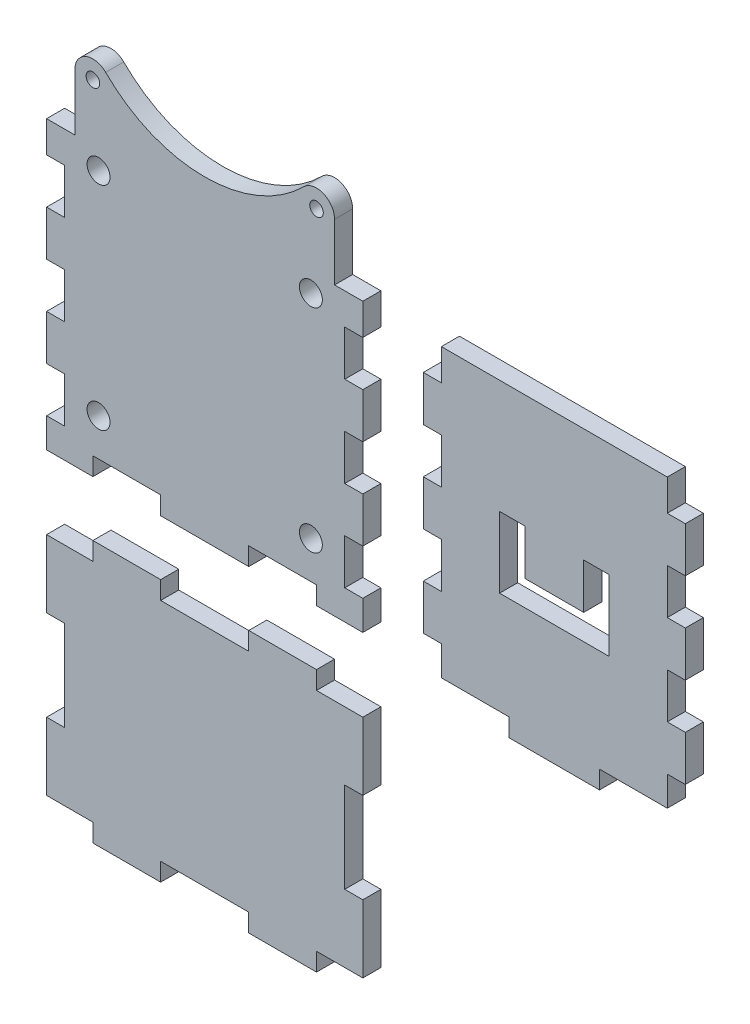
from build123d import *

# Parameters (mm, degrees)
SKETCH1_R             = 2.54
SKETCH1_R_2           = 1.5
BOSS_EXTRUDE1_DEPTH   = 4
BOSS_EXTRUDE1_2_DEPTH = 4
BOSS_EXTRUDE1_3_DEPTH = 4


with BuildPart() as part:
    # Sketch1 → Boss-Extrude1 (new body)
    with BuildSketch(Plane.XY):
        with BuildLine():
            Line((-35, -94.278824944), (-35, -100.830704015))
            Line((-35, -100.830704015), (-24.748737342, -100.830704015))
            Line((-24.748737342, -100.830704015), (-24.748737342, -96.830704015))
            Line((-24.748737342, -96.830704015), (-9.748737342, -96.830704015))
            Line((-9.748737342, -96.830704015), (-9.748737342, -100.830704015))
            Line((-9.748737342, -100.830704015), (9.748737342, -100.830704015))
            Line((9.748737342, -100.830704015), (9.748737342, -96.830704015))
            Line((9.748737342, -96.830704015), (24.748737342, -96.830704015))
            Line((24.748737342, -96.830704015), (24.748737342, -100.830704015))
            Line((24.748737342, -100.830704015), (35, -100.830704015))
            Line((35, -100.830704015), (35, -94.278824944))
            Line((35, -94.278824944), (31, -94.278824944))
            Line((31, -94.278824944), (31, -84.278824944))
            Line((31, -84.278824944), (35, -84.278824944))
            Line((35, -84.278824944), (35, -74.278824944))
            Line((35, -74.278824944), (31, -74.278824944))
            Line((31, -74.278824944), (31, -64.278824944))
            Line((31, -64.278824944), (35, -64.278824944))
            Line((35, -64.278824944), (35, -54.278824944))
            Line((35, -54.278824944), (31, -54.278824944))
            Line((31, -54.278824944), (31, -44.278824944))
            Line((31, -44.278824944), (35, -44.278824944))
            Line((35, -44.278824944), (35, -37.330704015))
            Line((35, -37.330704015), (28.748737342, -37.330704015))
            Line((28.748737342, -37.330704015), (28.748737342, -24.748737342))
            ThreePointArc((28.748737342, -24.748737342), (26.279471071, -21.053219211), (21.920310217, -21.920310217))
            ThreePointArc((21.920310217, -21.920310217), (0, -31), (-21.920310217, -21.920310217))
            ThreePointArc((-21.920310217, -21.920310217), (-26.279471071, -21.053219211), (-28.748737342, -24.748737342))
            Line((-28.748737342, -24.748737342), (-28.748737342, -37.330704015))
            Line((-28.748737342, -37.330704015), (-35, -37.330704015))
            Line((-35, -37.330704015), (-35, -44.278824944))
            Line((-35, -44.278824944), (-31, -44.278824944))
            Line((-31, -44.278824944), (-31, -54.278824944))
            Line((-31, -54.278824944), (-35, -54.278824944))
            Line((-35, -54.278824944), (-35, -64.278824944))
            Line((-35, -64.278824944), (-31, -64.278824944))
            Line((-31, -64.278824944), (-31, -74.278824944))
            Line((-31, -74.278824944), (-35, -74.278824944))
            Line((-35, -74.278824944), (-35, -84.278824944))
            Line((-35, -84.278824944), (-31, -84.278824944))
            Line((-31, -84.278824944), (-31, -94.278824944))
            Line((-31, -94.278824944), (-35, -94.278824944))
        make_face()
        with Locations((-23.5, -88.549683874)):
            Circle(SKETCH1_R, mode=Mode.SUBTRACT)
        with Locations((23.5, -88.549683874)):
            Circle(SKETCH1_R, mode=Mode.SUBTRACT)
        with Locations((-23.5, -41.549683874)):
            Circle(SKETCH1_R, mode=Mode.SUBTRACT)
        with Locations((-24.748737342, -24.748737342)):
            Circle(SKETCH1_R_2, mode=Mode.SUBTRACT)
        with Locations((23.5, -41.549683874)):
            Circle(SKETCH1_R, mode=Mode.SUBTRACT)
        with Locations((24.748737342, -24.748737342)):
            Circle(SKETCH1_R_2, mode=Mode.SUBTRACT)
    extrude(amount=BOSS_EXTRUDE1_DEPTH)


with BuildPart() as body_2:
    # Sketch1 → Boss-Extrude1 2 (new body)
    with BuildSketch(Plane.XY):
        Polygon((87.392932462, -104.830704015), (87.392932462, -100.830704015), (102.392932462, -100.830704015), (102.392932462, -94.278824944), (106.392932462, -94.278824944), (106.392932462, -84.278824944), (102.392932462, -84.278824944), (102.392932462, -74.278824944), (106.392932462, -74.278824944), (106.392932462, -64.278824944), (102.392932462, -64.278824944), (102.392932462, -54.278824944), (106.392932462, -54.278824944), (106.392932462, -44.278824944), (102.392932462, -44.278824944), (102.392932462, -37.330704015), (52.392932462, -37.330704015), (52.392932462, -44.278824944), (48.392932462, -44.278824944), (48.392932462, -54.278824944), (52.392932462, -54.278824944), (52.392932462, -64.278824944), (48.392932462, -64.278824944), (48.392932462, -74.278824944), (52.392932462, -74.278824944), (52.392932462, -84.278824944), (48.392932462, -84.278824944), (48.392932462, -94.278824944), (52.392932462, -94.278824944), (52.392932462, -100.830704015), (67.392932462, -100.830704015), (67.392932462, -104.830704015), align=None)
        Polygon((65.27265077, -78.159810059), (65.27265077, -62.481717659), (70.893098989, -62.481717659), (70.893098989, -72.53936184), (83.892765935, -72.53936184), (83.892765935, -62.481717659), (89.513214154, -62.481717659), (89.513214154, -78.159810059), align=None, mode=Mode.SUBTRACT)
    extrude(amount=BOSS_EXTRUDE1_2_DEPTH)


with BuildPart() as body_3:
    # Sketch1 → Boss-Extrude1 3 (new body)
    with BuildSketch(Plane.XY):
        Polygon((35, -117.070270322), (24.748737342, -117.070270322), (24.748737342, -113.070270322), (9.748737342, -113.070270322), (9.748737342, -117.070270322), (-9.748737342, -117.070270322), (-9.748737342, -113.070270322), (-24.748737342, -113.070270322), (-24.748737342, -117.070270322), (-35, -117.070270322), (-35, -132.070270322), (-31, -132.070270322), (-31, -152.070270322), (-35, -152.070270322), (-35, -167.070270322), (-24.748737342, -167.070270322), (-24.748737342, -171.070270322), (-9.748737342, -171.070270322), (-9.748737342, -167.070270322), (9.748737342, -167.070270322), (9.748737342, -171.070270322), (24.748737342, -171.070270322), (24.748737342, -167.070270322), (35, -167.070270322), (35, -152.070270322), (31, -152.070270322), (31, -132.070270322), (35, -132.070270322), align=None)
    extrude(amount=BOSS_EXTRUDE1_3_DEPTH)


solid = Compound([part.part, body_2.part, body_3.part])
